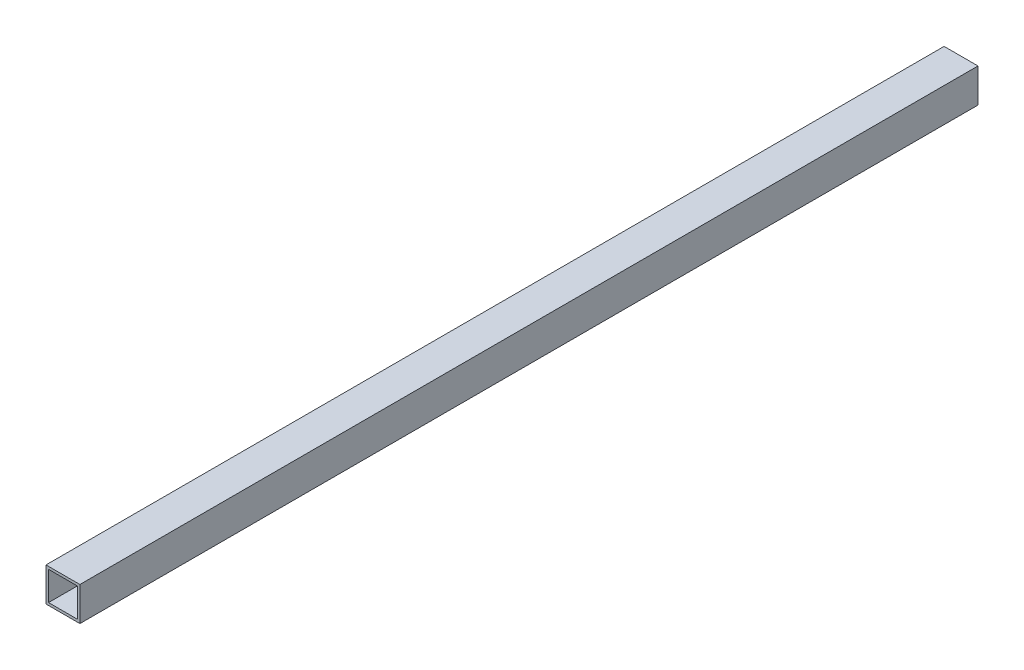
from build123d import *

# Parameters (mm, degrees)
SKETCH_2_W      = 20
SKETCH_2_H      = 20
SKETCH_2_W_2    = 17
SKETCH_2_H_2    = 17
EXTRUDE_1_DEPTH = 530


with BuildPart() as part:
    # ｽｹｯﾁ2 → ﾎﾞｽ - 押し出し1 (new body)
    with BuildSketch(Plane.XY):
        Rectangle(SKETCH_2_W, SKETCH_2_H)
        Rectangle(SKETCH_2_W_2, SKETCH_2_H_2, mode=Mode.SUBTRACT)
    extrude(amount=EXTRUDE_1_DEPTH)


solid = part.part
